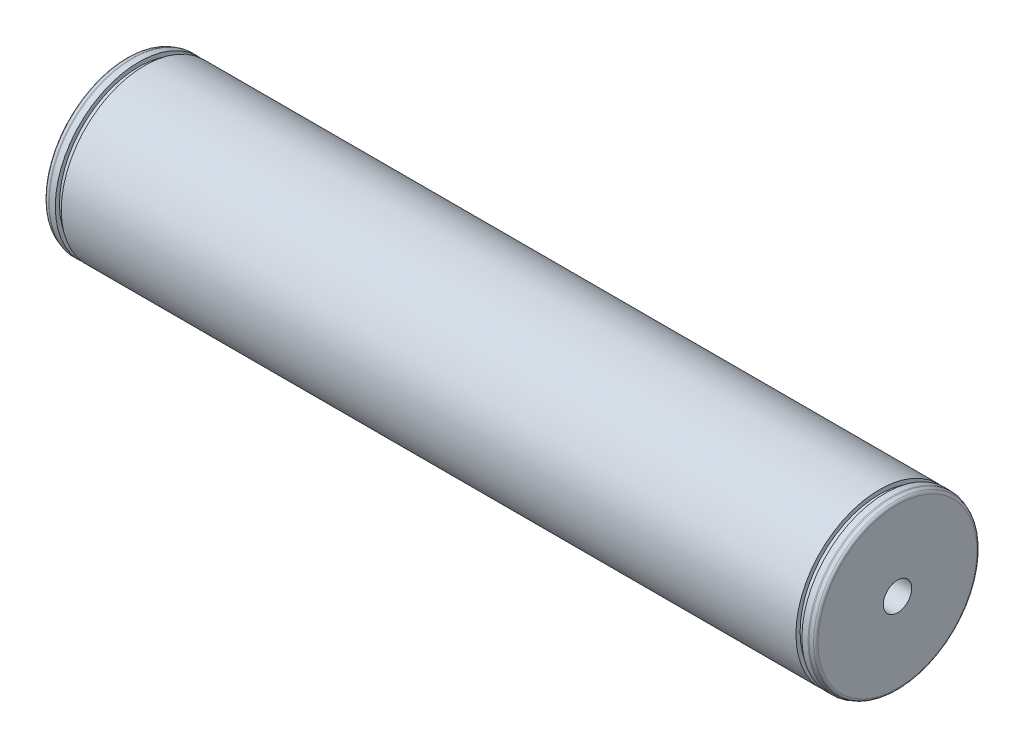
from build123d import *


with BuildPart() as part:
    # Sketch1 → Base-Revolve (revolve)
    with BuildSketch(Plane.XY, mode=Mode.PRIVATE) as base_revolve_sk:
        with BuildLine():
            Line((132, 30), (0, 30))
            Line((0, 30), (-132, 30))
            Line((-132, 30), (-132, 28.5))
            Line((-132, 28.5), (-134.15, 28.5))
            Line((-134.15, 28.5), (-134.15, 30))
            Line((-134.15, 30), (-136.323673019, 30))
            ThreePointArc((-136.323673019, 30), (-136.497321197, 29.984807753), (-136.665693163, 29.939692621))
            Line((-136.665693163, 29.939692621), (-137.842020143, 29.511544614))
            ThreePointArc((-137.842020143, 29.511544614), (-138.319152044, 29.14542843), (-138.5, 28.571851993))
            Line((-138.5, 28.571851993), (-138.5, 0))
            Line((-138.5, 0), (115.555513627, 0))
            Line((115.555513627, 0), (118.5, 5.1))
            Line((118.5, 5.1), (138.5, 5.1))
            Line((138.5, 5.1), (138.5, 28.571851993))
            ThreePointArc((138.5, 28.571851993), (138.319152044, 29.14542843), (137.842020143, 29.511544614))
            Line((137.842020143, 29.511544614), (136.665693163, 29.939692621))
            ThreePointArc((136.665693163, 29.939692621), (136.497321197, 29.984807753), (136.323673019, 30))
            Line((136.323673019, 30), (134.15, 30))
            Line((134.15, 30), (134.15, 28.5))
            Line((134.15, 28.5), (132, 28.5))
            Line((132, 28.5), (132, 30))
        make_face()
    revolve(base_revolve_sk.sketch.rotate(Axis((-138.5, 0, 0), (1, 0, 0)), 90), axis=Axis((-138.5, 0, 0), (1, 0, 0)))


solid = part.part
